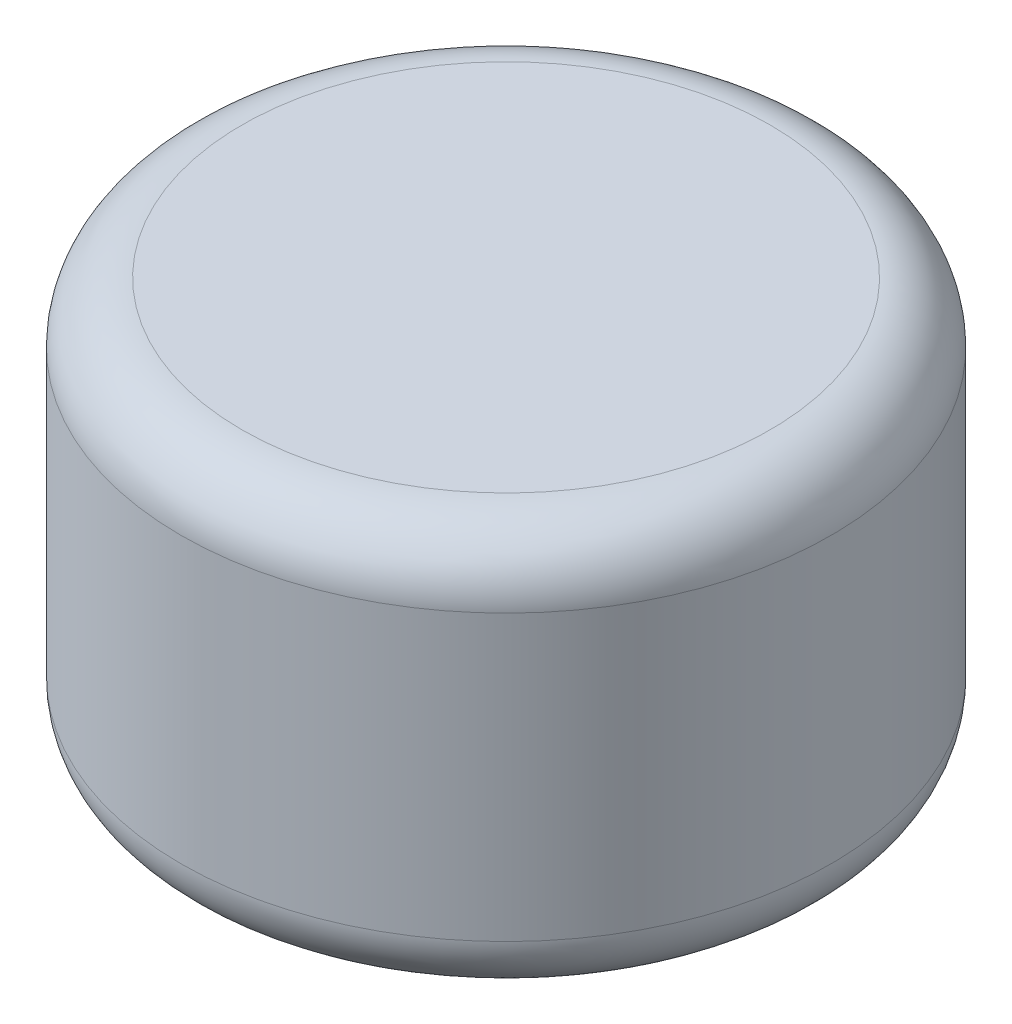
from build123d import *

# Parameters (mm, degrees)
SKETCH1_R           = 16
BOSS_EXTRUDE1_DEPTH = 20
SKETCH2_R           = 14.5
CUT_EXTRUDE1_DEPTH  = 18
BOSS_EXTRUDE2_START = -2
SKETCH3_R           = 16
BOSS_EXTRUDE2_DEPTH = 2
FILLET1_R           = 5
FILLET2_R           = 3


with BuildPart() as part:
    # Sketch1 → Boss-Extrude1 (new body)
    with BuildSketch(Plane(origin=(0, 0, 0), x_dir=(1, 0, 0), z_dir=(0, 1, 0))):
        with Locations(Location((0, 0, 0), (0, 0, 270))):
            Circle(SKETCH1_R)
    extrude(amount=BOSS_EXTRUDE1_DEPTH)

    # Sketch2 → Cut-Extrude1 (cut)
    with BuildSketch(Plane(origin=(0, 20, 0), x_dir=(1, 0, 0), z_dir=(0, 1, 0))):
        with Locations(Location((0, 0, 0), (0, 0, 270))):
            Circle(SKETCH2_R)
    extrude(amount=-CUT_EXTRUDE1_DEPTH, mode=Mode.SUBTRACT)

    # Sketch3 → Boss-Extrude2 (add)
    with BuildSketch(Plane(origin=(0, 20, 0), x_dir=(1, 0, 0), z_dir=(0, 1, 0)).offset(BOSS_EXTRUDE2_START)):
        with Locations(Location((0, 0, 0), (0, 0, 270))):
            Circle(SKETCH3_R)
    extrude(amount=BOSS_EXTRUDE2_DEPTH)

    # Fillet1
    fillet1_edges = [part.edges().sort_by_distance(p)[0] for p in [
        (0, 18, -14.5),
        (0, 2, -14.5),
    ]]
    fillet(fillet1_edges, radius=FILLET1_R)

    # Fillet2
    fillet2_edges = [part.edges().sort_by_distance(p)[0] for p in [
        (0, 0, -16),
        (0, 20, -16),
    ]]
    fillet(fillet2_edges, radius=FILLET2_R)


solid = part.part
